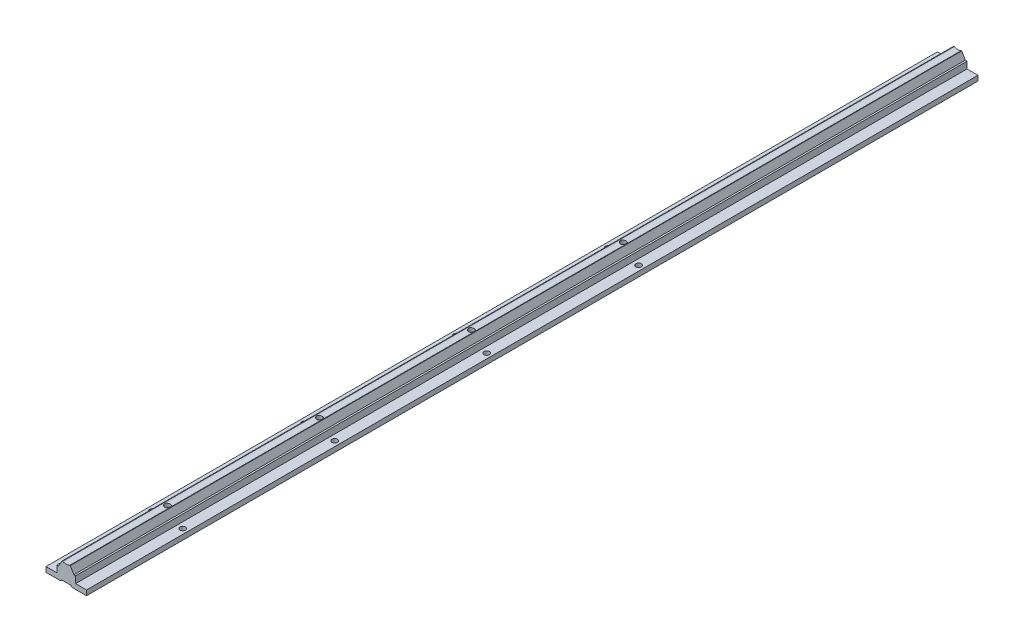
from build123d import *

# Parameters (mm, degrees)
LENGTH_DEPTH                            = 880
CUT_EXTRUDE1_REACH                      = 882.407
SKETCH2_R                               = 2.75
CBORE_FOR_M5_HEX_HEAD_BOLT1_D           = 5.5
CBORE_FOR_M5_HEX_HEAD_BOLT1_CBORE_D     = 9.5
CBORE_FOR_M5_HEX_HEAD_BOLT1_CBORE_DEPTH = 3.58
LPATTERN1_COUNT                         = 4
LPATTERN1_PITCH                         = 150
LPATTERN2_COUNT                         = 4
LPATTERN2_PITCH                         = 150


with BuildPart() as part:
    # Sketch1 → Length (new body)
    with BuildSketch(Plane.XY):
        with BuildLine():
            Line((-20, -25), (-5.471687836, -25))
            Line((-5.471687836, -25), (-4.75, -23.75))
            Line((-4.75, -23.75), (4.75, -23.75))
            Line((4.75, -23.75), (5.471687836, -25))
            Line((5.471687836, -25), (20, -25))
            Line((20, -25), (20, -20))
            Line((20, -20), (9.25, -20))
            Line((9.25, -20), (9.25, -13.3))
            Line((9.25, -13.3), (7.521836642, -13.3))
            Line((7.521836642, -13.3), (4, -7.2))
            Line((4, -7.2), (3.487119155, -7.2))
            ThreePointArc((3.487119155, -7.2), (0, -8), (-3.487119155, -7.2))
            Line((-3.487119155, -7.2), (-4, -7.2))
            Line((-4, -7.2), (-7.521836642, -13.3))
            Line((-7.521836642, -13.3), (-9.25, -13.3))
            Line((-9.25, -13.3), (-9.25, -20))
            Line((-9.25, -20), (-20, -20))
            Line((-20, -20), (-20, -25))
        make_face()
    extrude(amount=LENGTH_DEPTH)

    # Sketch2 → Cut-Extrude1 (cut, up to next)
    with BuildSketch(Plane.XZ.offset(25), mode=Mode.PRIVATE) as cut_extrude1_sk1:
        with Locations((-15, 780)):
            Circle(SKETCH2_R)
    cut_extrude1_tool1 = extrude(cut_extrude1_sk1.sketch, amount=-CUT_EXTRUDE1_REACH, mode=Mode.PRIVATE) & part.part
    # Sketch2 → Cut-Extrude1 (cut, up to next)
    with BuildSketch(Plane.XZ.offset(25), mode=Mode.PRIVATE) as cut_extrude1_sk2:
        with Locations((15, 780)):
            Circle(SKETCH2_R)
    cut_extrude1_tool2 = extrude(cut_extrude1_sk2.sketch, amount=-CUT_EXTRUDE1_REACH, mode=Mode.PRIVATE) & part.part
    cut_extrude1_1 = cut_extrude1_tool1.solids().sort_by_distance((-15, -25, 780))[0]
    add(cut_extrude1_1, mode=Mode.SUBTRACT)
    cut_extrude1_2 = cut_extrude1_tool2.solids().sort_by_distance((15, -25, 780))[0]
    add(cut_extrude1_2, mode=Mode.SUBTRACT)
    cut_extrude1 = cut_extrude1_1 + cut_extrude1_2  # Cut-Extrude1 as one shape, for the pattern or mirror that repeats it

    # CBORE for M5 Hex Head Bolt1 (through all)
    with Locations(Plane.XZ.offset(23.75)):
        with Locations((0, 780)):
            cbore_for_m5_hex_head_bolt1 = CounterBoreHole(CBORE_FOR_M5_HEX_HEAD_BOLT1_D / 2, CBORE_FOR_M5_HEX_HEAD_BOLT1_CBORE_D / 2, CBORE_FOR_M5_HEX_HEAD_BOLT1_CBORE_DEPTH)

    # LPattern1: Cut-Extrude1 ×4
    with Locations(*[(0, 0, -i * LPATTERN1_PITCH) for i in range(1, LPATTERN1_COUNT)]):
        add(cut_extrude1, mode=Mode.SUBTRACT)

    # LPattern2: CBORE for M5 Hex Head Bolt1 ×4
    with Locations(*[(0, 0, -i * LPATTERN2_PITCH) for i in range(1, LPATTERN2_COUNT)]):
        add(cbore_for_m5_hex_head_bolt1, mode=Mode.SUBTRACT)


solid = part.part
